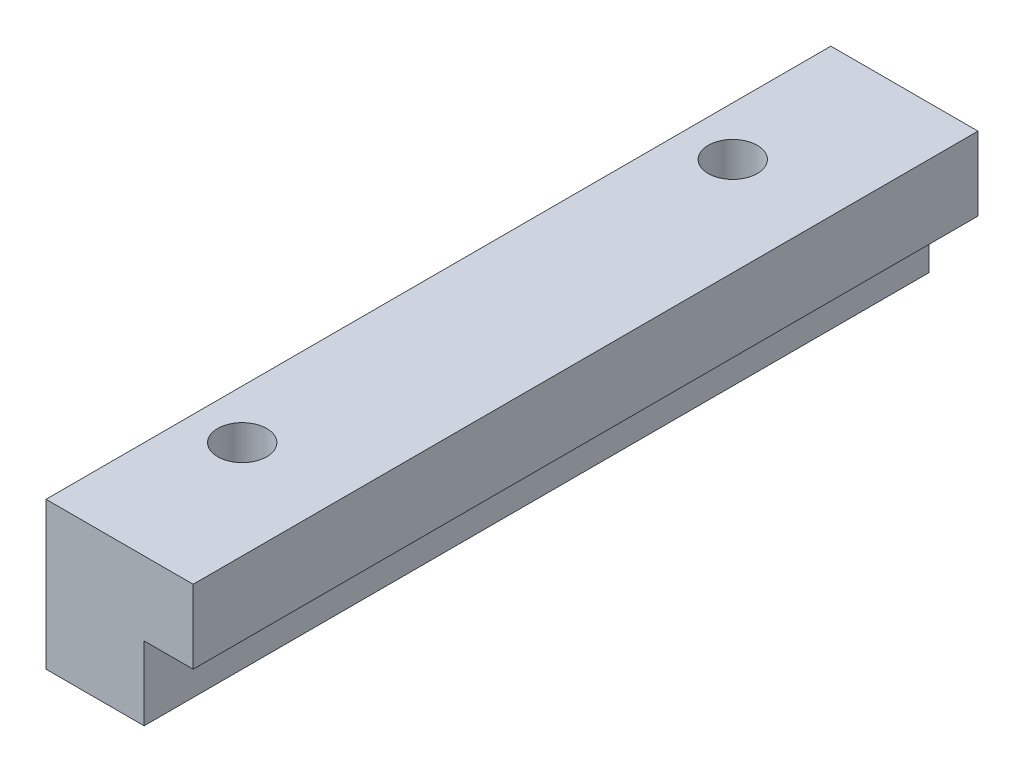
from build123d import *

# Parameters (mm, degrees)
SKETCH1_W                       = 19.05
SKETCH1_H                       = 101.6
BOSS_EXTRUDE1_DEPTH             = 9.525
SKETCH2_W                       = 6.35
SKETCH2_H                       = 9.525
CUT_EXTRUDE1_DEPTH              = 103.489078686
F_1_4_0_25_DIAMETER_HOLE1_D     = 6.35
F_1_4_0_25_DIAMETER_HOLE1_DEPTH = 25.4
F_1_4_0_25_DIAMETER_HOLE1_TIP   = 1.907732465


with BuildPart() as part:
    # Sketch1 → Boss-Extrude1 (new, symmetric)
    with BuildSketch(Plane(origin=(0, 0, 0), x_dir=(1, 0, 0), z_dir=(0, 1, 0))):
        Rectangle(SKETCH1_W, SKETCH1_H)
    extrude(amount=BOSS_EXTRUDE1_DEPTH, both=True)

    # Sketch2 → Cut-Extrude1 (cut, through all)
    with BuildSketch(Plane.XY.offset(50.8)):
        with Locations((6.35, -4.7625)):
            Rectangle(SKETCH2_W, SKETCH2_H)
    extrude(amount=-CUT_EXTRUDE1_DEPTH, mode=Mode.SUBTRACT)

    # 1/4 (0.25) Diameter Hole1
    with Locations(Plane(origin=(0, 9.525, 0), x_dir=(1, 0, 0), z_dir=(0, 1, 0))):
        with Locations((-3.175, 31.75), (-3.175, -31.75)):
            Hole(F_1_4_0_25_DIAMETER_HOLE1_D / 2, depth=F_1_4_0_25_DIAMETER_HOLE1_DEPTH)
            with Locations((0, 0, -(F_1_4_0_25_DIAMETER_HOLE1_DEPTH + F_1_4_0_25_DIAMETER_HOLE1_TIP / 2))):  # 118° drill point
                Cone(0, F_1_4_0_25_DIAMETER_HOLE1_D / 2, F_1_4_0_25_DIAMETER_HOLE1_TIP, mode=Mode.SUBTRACT)


solid = part.part
